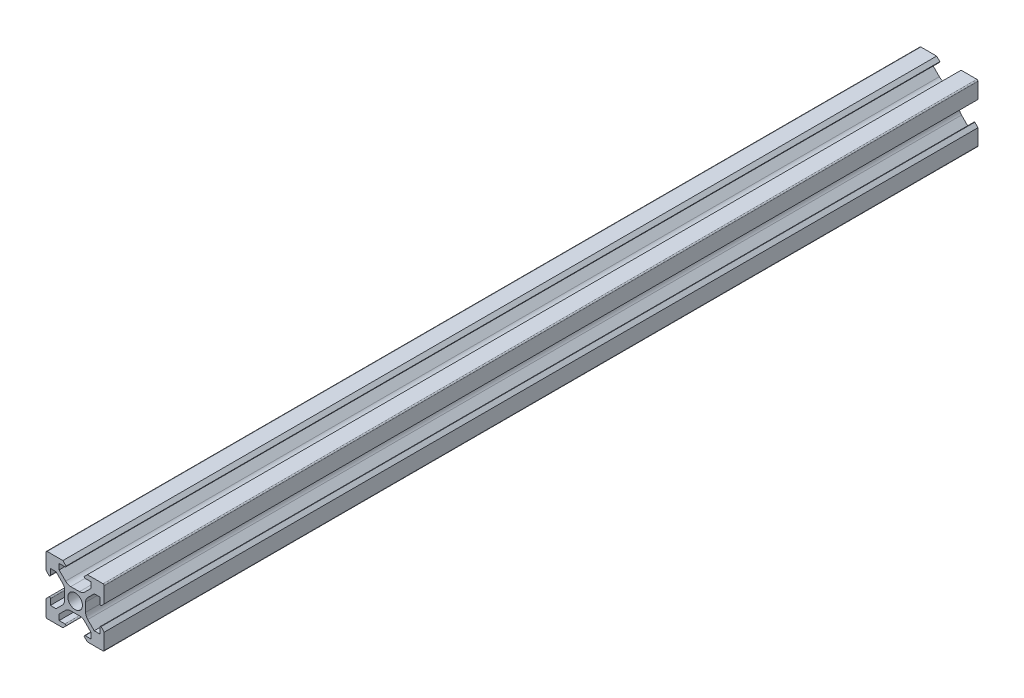
from build123d import *

# Parameters (mm, degrees)
RESSALTO_EXTRUS_O1_DEPTH = 150


with BuildPart() as part:
    # Esboço1 → Ressalto-extrusão1 (new, symmetric)
    with BuildSketch(Plane.XY):
        with BuildLine():
            Line((-3.1, 8.9), (-4.2, 10))
            Line((-4.2, 10), (-9.6, 10))
            ThreePointArc((-9.6, 10), (-9.882842712, 9.882842712), (-10, 9.6))
            Line((-10, 9.6), (-10, 4.2))
            Line((-10, 4.2), (-8.9, 3.1))
            ThreePointArc((-8.9, 3.1), (-8.617157287, 3.217157287), (-8.5, 3.5))
            Line((-8.5, 3.5), (-8.5, 5.5))
            Line((-8.5, 5.5), (-6.560660172, 5.5))
            Line((-6.560660172, 5.5), (-4.332233047, 3.271572875))
            ThreePointArc((-4.332233047, 3.271572875), (-3.790301169, 2.460514503), (-3.6, 1.503805922))
            Line((-3.6, 1.503805922), (-3.6, 0))
            Line((-3.6, 0), (-3.6, -1.503805922))
            ThreePointArc((-3.6, -1.503805922), (-3.790301169, -2.460514503), (-4.332233047, -3.271572875))
            Line((-4.332233047, -3.271572875), (-6.560660172, -5.5))
            Line((-6.560660172, -5.5), (-8.5, -5.5))
            Line((-8.5, -5.5), (-8.5, -3.5))
            ThreePointArc((-8.5, -3.5), (-8.617157287, -3.217157288), (-8.9, -3.1))
            Line((-8.9, -3.1), (-10, -4.2))
            Line((-10, -4.2), (-10, -9.6))
            ThreePointArc((-10, -9.6), (-9.882842712, -9.882842712), (-9.6, -10))
            Line((-9.6, -10), (-4.2, -10))
            Line((-4.2, -10), (-3.1, -8.9))
            ThreePointArc((-3.1, -8.9), (-3.217157287, -8.617157288), (-3.5, -8.5))
            Line((-3.5, -8.5), (-5.5, -8.5))
            Line((-5.5, -8.5), (-5.5, -6.560660172))
            Line((-5.5, -6.560660172), (-3.271572875, -4.332233047))
            ThreePointArc((-3.271572875, -4.332233047), (-2.460514503, -3.790301169), (-1.503805922, -3.6))
            Line((-1.503805922, -3.6), (1.503805922, -3.6))
            ThreePointArc((1.503805922, -3.6), (2.460514503, -3.790301169), (3.271572875, -4.332233047))
            Line((3.271572875, -4.332233047), (5.5, -6.560660172))
            Line((5.5, -6.560660172), (5.5, -8.5))
            Line((5.5, -8.5), (3.5, -8.5))
            ThreePointArc((3.5, -8.5), (3.217157288, -8.617157288), (3.1, -8.9))
            Line((3.1, -8.9), (4.2, -10))
            Line((4.2, -10), (9.6, -10))
            ThreePointArc((9.6, -10), (9.882842713, -9.882842712), (10, -9.6))
            Line((10, -9.6), (10, -4.2))
            Line((10, -4.2), (8.9, -3.1))
            ThreePointArc((8.9, -3.1), (8.617157288, -3.217157288), (8.5, -3.5))
            Line((8.5, -3.5), (8.5, -5.5))
            Line((8.5, -5.5), (6.560660172, -5.5))
            Line((6.560660172, -5.5), (4.332233047, -3.271572875))
            ThreePointArc((4.332233047, -3.271572875), (3.790301169, -2.460514503), (3.6, -1.503805922))
            Line((3.6, -1.503805922), (3.6, 0))
            Line((3.6, 0), (3.6, 1.503805922))
            ThreePointArc((3.6, 1.503805922), (3.790301169, 2.460514503), (4.332233047, 3.271572875))
            Line((4.332233047, 3.271572875), (6.560660172, 5.5))
            Line((6.560660172, 5.5), (8.5, 5.5))
            Line((8.5, 5.5), (8.5, 3.5))
            ThreePointArc((8.5, 3.5), (8.617157288, 3.217157287), (8.9, 3.1))
            Line((8.9, 3.1), (10, 4.2))
            Line((10, 4.2), (10, 9.6))
            ThreePointArc((10, 9.6), (9.882842713, 9.882842712), (9.6, 10))
            Line((9.6, 10), (4.2, 10))
            Line((4.2, 10), (3.1, 8.9))
            ThreePointArc((3.1, 8.9), (3.217157288, 8.617157287), (3.5, 8.5))
            Line((3.5, 8.5), (5.5, 8.5))
            Line((5.5, 8.5), (5.5, 6.560660172))
            Line((5.5, 6.560660172), (3.271572875, 4.332233047))
            ThreePointArc((3.271572875, 4.332233047), (2.460514503, 3.790301169), (1.503805922, 3.6))
            Line((1.503805922, 3.6), (-1.503805922, 3.6))
            ThreePointArc((-1.503805922, 3.6), (-2.460514503, 3.790301169), (-3.271572875, 4.332233047))
            Line((-3.271572875, 4.332233047), (-5.5, 6.560660172))
            Line((-5.5, 6.560660172), (-5.5, 8.5))
            Line((-5.5, 8.5), (-3.5, 8.5))
            ThreePointArc((-3.5, 8.5), (-3.217157287, 8.617157287), (-3.1, 8.9))
        make_face()
        with BuildLine():
            ThreePointArc((2.5, 0), (0, 2.5), (-2.5, 0))
            ThreePointArc((-2.5, 0), (0, -2.5), (2.5, 0))
        make_face(mode=Mode.SUBTRACT)
    extrude(amount=RESSALTO_EXTRUS_O1_DEPTH, both=True)


solid = part.part
